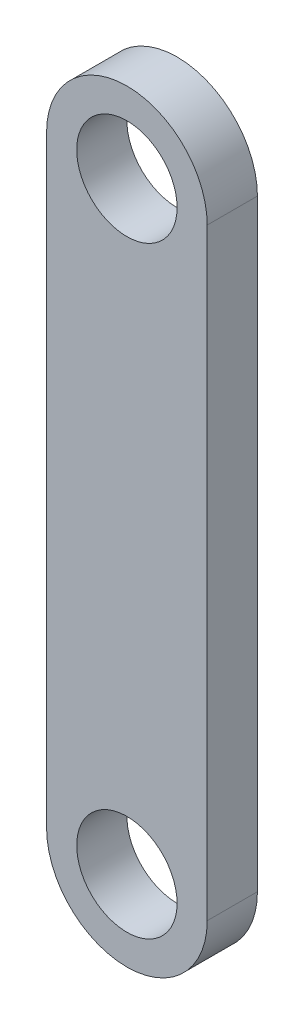
from build123d import *

# Parameters (mm, degrees)
SKETCH_1_R      = 0.5
EXTRUDE_1_DEPTH = 0.5


with BuildPart() as part:
    # 草圖1 → 填料-伸長1 (new body)
    with BuildSketch(Plane.XY):
        with BuildLine():
            Line((-0.8, -3), (-0.8, 3))
            ThreePointArc((-0.8, 3), (0, 3.8), (0.8, 3))
            Line((0.8, 3), (0.8, -3))
            ThreePointArc((0.8, -3), (0, -3.8), (-0.8, -3))
        make_face()
        with Locations((0, 3)):
            Circle(SKETCH_1_R, mode=Mode.SUBTRACT)
        with Locations((0, -3)):
            Circle(SKETCH_1_R, mode=Mode.SUBTRACT)
    extrude(amount=EXTRUDE_1_DEPTH)


solid = part.part
